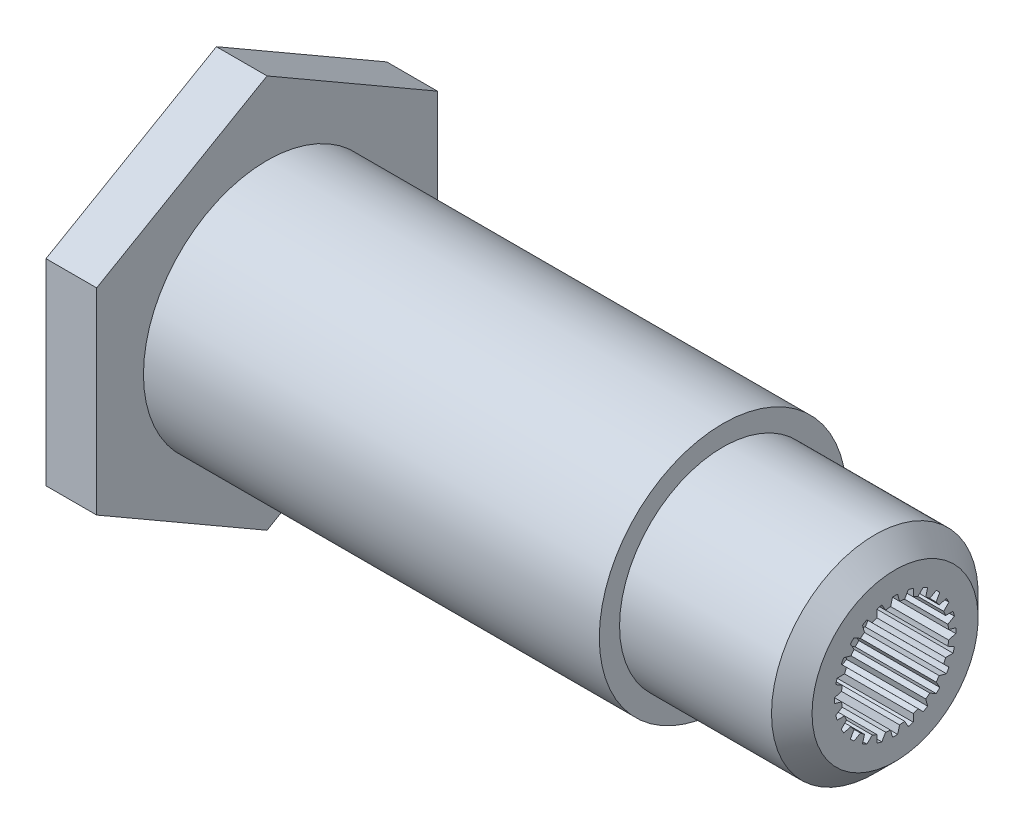
from build123d import *

# Parameters (mm, degrees)
EXTRUDE_1_DEPTH     = 2.5
CUT_EXTRUDE_1_DEPTH = 4


with BuildPart() as part:
    # Эскиз1 → Бобышка-Вытянуть1 (new body)
    with BuildSketch(Plane(origin=(0, 0, 0), x_dir=(0, 0, -1), z_dir=(1, 0, 0))):
        Polygon((0, 9.711324865), (-8.410254038, 4.855662433), (-8.410254038, -4.855662433), (0, -9.711324865), (8.410254038, -4.855662433), (8.410254038, 4.855662433), align=None)
    extrude(amount=-EXTRUDE_1_DEPTH)

    # Эскиз3 → Повернуть1 (revolve)
    with BuildSketch(Plane.XY, mode=Mode.PRIVATE) as revolve_1_sk:
        Polygon((0, 0), (0, 6.1), (22.5, 6.1), (22.5, 5.1), (30, 5.1), (31, 4.1), (31, 0), align=None)
    revolve(revolve_1_sk.sketch.rotate(Axis((-6.877569373, 0, 0), (1, 0, 0)), 90), axis=Axis((-6.877569373, 0, 0), (1, 0, 0)))

    # Эскиз4 → Вырез-Вытянуть1 (cut)
    with BuildSketch(Plane(origin=(31, 0, -31), x_dir=(0, 0, 1), z_dir=(-1, 0, 0))):
        with BuildLine():
            Line((30.778386531, 2.640717227), (30.875027145, 2.996524002))
            ThreePointArc((30.875027145, 2.996524002), (31, 2.999128925), (31.124972855, 2.996524002))
            Line((31.124972855, 2.996524002), (31.221613469, 2.640717227))
            ThreePointArc((31.221613469, 2.640717227), (31.345894409, 2.627328883), (31.469405738, 2.608094755))
            Line((31.469405738, 2.608094755), (31.654842973, 2.926765277))
            ThreePointArc((31.654842973, 2.926765277), (31.776231684, 2.896936085), (31.896271989, 2.862074568))
            Line((31.896271989, 2.862074568), (31.897530084, 2.493379183))
            ThreePointArc((31.897530084, 2.493379183), (32.014111096, 2.448280761), (32.12843572, 2.397734937))
            Line((32.12843572, 2.397734937), (32.390032334, 2.657552336))
            ThreePointArc((32.390032334, 2.657552336), (32.499564462, 2.597321838), (32.606491668, 2.532579481))
            Line((32.606491668, 2.532579481), (32.512281507, 2.176121468))
            ThreePointArc((32.512281507, 2.176121468), (32.613217787, 2.102386352), (32.710564672, 2.023973445))
            Line((32.710564672, 2.023973445), (33.030493289, 2.207231595))
            ThreePointArc((33.030493289, 2.207231595), (33.1207044, 2.1207044), (33.207231595, 2.030493289))
            Line((33.207231595, 2.030493289), (33.023973445, 1.710564672))
            ThreePointArc((33.023973445, 1.710564672), (33.102386352, 1.613217787), (33.176121468, 1.512281507))
            Line((33.176121468, 1.512281507), (33.532579481, 1.606491668))
            ThreePointArc((33.532579481, 1.606491668), (33.597321838, 1.499564462), (33.657552336, 1.390032334))
            Line((33.657552336, 1.390032334), (33.397734937, 1.12843572))
            ThreePointArc((33.397734937, 1.12843572), (33.448280761, 1.014111096), (33.493379183, 0.897530084))
            Line((33.493379183, 0.897530084), (33.862074568, 0.896271989))
            ThreePointArc((33.862074568, 0.896271989), (33.896936085, 0.776231684), (33.926765277, 0.654842973))
            Line((33.926765277, 0.654842973), (33.608094755, 0.469405738))
            ThreePointArc((33.608094755, 0.469405738), (33.627328883, 0.345894409), (33.640717227, 0.221613469))
            Line((33.640717227, 0.221613469), (33.996524002, 0.124972855))
            ThreePointArc((33.996524002, 0.124972855), (33.999128925, 0), (33.996524002, -0.124972855))
            Line((33.996524002, -0.124972855), (33.640717227, -0.221613469))
            ThreePointArc((33.640717227, -0.221613469), (33.627328883, -0.345894409), (33.608094755, -0.469405738))
            Line((33.608094755, -0.469405738), (33.926765277, -0.654842973))
            ThreePointArc((33.926765277, -0.654842973), (33.896936085, -0.776231684), (33.862074568, -0.896271989))
            Line((33.862074568, -0.896271989), (33.493379183, -0.897530084))
            ThreePointArc((33.493379183, -0.897530084), (33.448280761, -1.014111096), (33.397734937, -1.12843572))
            Line((33.397734937, -1.12843572), (33.657552336, -1.390032334))
            ThreePointArc((33.657552336, -1.390032334), (33.597321838, -1.499564462), (33.532579481, -1.606491668))
            Line((33.532579481, -1.606491668), (33.176121468, -1.512281507))
            ThreePointArc((33.176121468, -1.512281507), (33.102386352, -1.613217787), (33.023973445, -1.710564672))
            Line((33.023973445, -1.710564672), (33.207231595, -2.030493289))
            ThreePointArc((33.207231595, -2.030493289), (33.1207044, -2.1207044), (33.030493289, -2.207231595))
            Line((33.030493289, -2.207231595), (32.710564672, -2.023973445))
            ThreePointArc((32.710564672, -2.023973445), (32.613217787, -2.102386352), (32.512281507, -2.176121468))
            Line((32.512281507, -2.176121468), (32.606491668, -2.532579481))
            ThreePointArc((32.606491668, -2.532579481), (32.499564462, -2.597321838), (32.390032334, -2.657552336))
            Line((32.390032334, -2.657552336), (32.12843572, -2.397734937))
            ThreePointArc((32.12843572, -2.397734937), (32.014111096, -2.448280761), (31.897530084, -2.493379183))
            Line((31.897530084, -2.493379183), (31.896271989, -2.862074568))
            ThreePointArc((31.896271989, -2.862074568), (31.776231684, -2.896936085), (31.654842973, -2.926765277))
            Line((31.654842973, -2.926765277), (31.469405738, -2.608094755))
            ThreePointArc((31.469405738, -2.608094755), (31.345894409, -2.627328883), (31.221613469, -2.640717227))
            Line((31.221613469, -2.640717227), (31.124972855, -2.996524002))
            ThreePointArc((31.124972855, -2.996524002), (31, -2.999128925), (30.875027145, -2.996524002))
            Line((30.875027145, -2.996524002), (30.778386531, -2.640717227))
            ThreePointArc((30.778386531, -2.640717227), (30.654105591, -2.627328883), (30.530594262, -2.608094755))
            Line((30.530594262, -2.608094755), (30.345157027, -2.926765277))
            ThreePointArc((30.345157027, -2.926765277), (30.223768316, -2.896936085), (30.103728011, -2.862074568))
            Line((30.103728011, -2.862074568), (30.102469916, -2.493379183))
            ThreePointArc((30.102469916, -2.493379183), (29.985888904, -2.448280761), (29.87156428, -2.397734937))
            Line((29.87156428, -2.397734937), (29.609967666, -2.657552336))
            ThreePointArc((29.609967666, -2.657552336), (29.500435538, -2.597321838), (29.393508332, -2.532579481))
            Line((29.393508332, -2.532579481), (29.487718493, -2.176121468))
            ThreePointArc((29.487718493, -2.176121468), (29.386782213, -2.102386352), (29.289435328, -2.023973445))
            Line((29.289435328, -2.023973445), (28.969506711, -2.207231595))
            ThreePointArc((28.969506711, -2.207231595), (28.8792956, -2.1207044), (28.792768405, -2.030493289))
            Line((28.792768405, -2.030493289), (28.976026555, -1.710564672))
            ThreePointArc((28.976026555, -1.710564672), (28.897613648, -1.613217787), (28.823878532, -1.512281507))
            Line((28.823878532, -1.512281507), (28.467420519, -1.606491668))
            ThreePointArc((28.467420519, -1.606491668), (28.402678162, -1.499564462), (28.342447664, -1.390032334))
            Line((28.342447664, -1.390032334), (28.602265063, -1.12843572))
            ThreePointArc((28.602265063, -1.12843572), (28.551719239, -1.014111096), (28.506620817, -0.897530084))
            Line((28.506620817, -0.897530084), (28.137925432, -0.896271989))
            ThreePointArc((28.137925432, -0.896271989), (28.103063915, -0.776231684), (28.073234723, -0.654842973))
            Line((28.073234723, -0.654842973), (28.391905245, -0.469405738))
            ThreePointArc((28.391905245, -0.469405738), (28.372671117, -0.345894409), (28.359282773, -0.221613469))
            Line((28.359282773, -0.221613469), (28.003475998, -0.124972855))
            ThreePointArc((28.003475998, -0.124972855), (28.000871075, 0), (28.003475998, 0.124972855))
            Line((28.003475998, 0.124972855), (28.359282773, 0.221613469))
            ThreePointArc((28.359282773, 0.221613469), (28.372671117, 0.345894409), (28.391905245, 0.469405738))
            Line((28.391905245, 0.469405738), (28.073234723, 0.654842973))
            ThreePointArc((28.073234723, 0.654842973), (28.103063915, 0.776231684), (28.137925432, 0.896271989))
            Line((28.137925432, 0.896271989), (28.506620817, 0.897530084))
            ThreePointArc((28.506620817, 0.897530084), (28.551719239, 1.014111096), (28.602265063, 1.12843572))
            Line((28.602265063, 1.12843572), (28.342447664, 1.390032334))
            ThreePointArc((28.342447664, 1.390032334), (28.402678162, 1.499564462), (28.467420519, 1.606491668))
            Line((28.467420519, 1.606491668), (28.823878532, 1.512281507))
            ThreePointArc((28.823878532, 1.512281507), (28.897613648, 1.613217787), (28.976026555, 1.710564672))
            Line((28.976026555, 1.710564672), (28.792768405, 2.030493289))
            ThreePointArc((28.792768405, 2.030493289), (28.8792956, 2.1207044), (28.969506711, 2.207231595))
            Line((28.969506711, 2.207231595), (29.289435328, 2.023973445))
            ThreePointArc((29.289435328, 2.023973445), (29.386782213, 2.102386352), (29.487718493, 2.176121468))
            Line((29.487718493, 2.176121468), (29.393508332, 2.532579481))
            ThreePointArc((29.393508332, 2.532579481), (29.500435538, 2.597321838), (29.609967666, 2.657552336))
            Line((29.609967666, 2.657552336), (29.87156428, 2.397734937))
            ThreePointArc((29.87156428, 2.397734937), (29.985888904, 2.448280761), (30.102469916, 2.493379183))
            Line((30.102469916, 2.493379183), (30.103728011, 2.862074568))
            ThreePointArc((30.103728011, 2.862074568), (30.223768316, 2.896936085), (30.345157027, 2.926765277))
            Line((30.345157027, 2.926765277), (30.530594262, 2.608094755))
            ThreePointArc((30.530594262, 2.608094755), (30.654105591, 2.627328883), (30.778386531, 2.640717227))
        make_face()
    extrude(amount=CUT_EXTRUDE_1_DEPTH, mode=Mode.SUBTRACT)


solid = part.part
